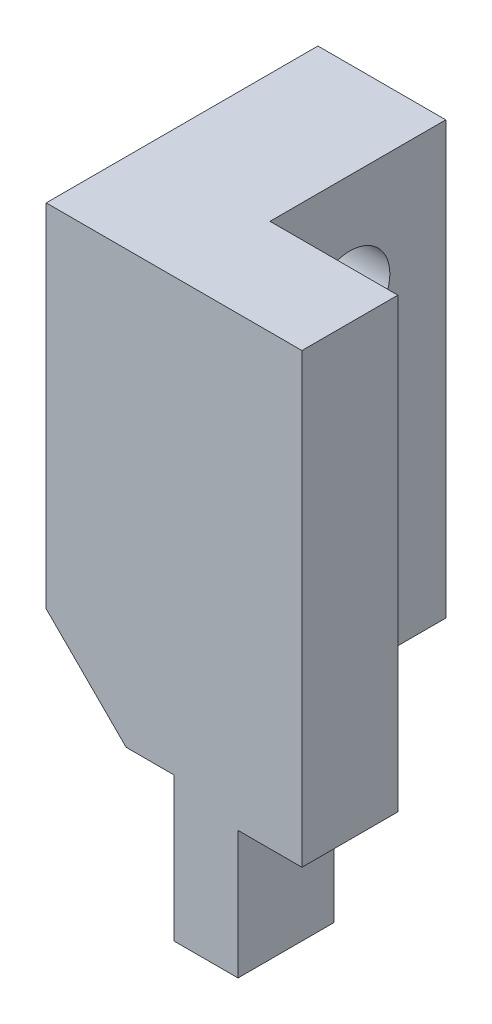
from build123d import *

# Parameters (mm, degrees)
SKETCH_1_W          = 8
SKETCH_1_H          = 18
EXTRUDE_1_DEPTH     = 8.5
SKETCH_2_W          = 2
SKETCH_2_H          = 4
CUT_EXTRUDE_1_DEPTH = 22.453437953
SKETCH_3_W          = 4
SKETCH_3_H          = 5.5
CUT_EXTRUDE_2_DEPTH = 22.453437953
SKETCH_4_W          = 5.5
SKETCH_4_H          = 4
CUT_EXTRUDE_3_DEPTH = 7
SKETCH_5_W          = 4
SKETCH_5_H          = 4.5
CUT_EXTRUDE_4_DEPTH = 22.453437953
CHAMFER_1_SIZE      = 2.5
HOLE_WIZARD_M3_1_D  = 2.5


with BuildPart() as part:
    # 草图1 → 凸台-拉伸1 (new body)
    with BuildSketch(Plane.XY):
        with Locations((4, 9)):
            Rectangle(SKETCH_1_W, SKETCH_1_H)
    extrude(amount=EXTRUDE_1_DEPTH)

    # 草图2 → 切除-拉伸1 (cut, through all)
    with BuildSketch(Plane.XY.offset(8.5)):
        with Locations((7, 2)):
            Rectangle(SKETCH_2_W, SKETCH_2_H)
    extrude(amount=-CUT_EXTRUDE_1_DEPTH, mode=Mode.SUBTRACT)

    # 草图3 → 切除-拉伸2 (cut, through all)
    with BuildSketch(Plane(origin=(0, 18, 0), x_dir=(1, 0, 0), z_dir=(0, 1, 0))):
        with Locations((6, -2.75)):
            Rectangle(SKETCH_3_W, SKETCH_3_H)
    extrude(amount=-CUT_EXTRUDE_2_DEPTH, mode=Mode.SUBTRACT)

    # 草图4 → 切除-拉伸3 (cut)
    with BuildSketch(Plane(origin=(4, 0, 0), x_dir=(0, 0, -1), z_dir=(1, 0, 0))):
        with Locations((-2.75, 2)):
            Rectangle(SKETCH_4_W, SKETCH_4_H)
    extrude(amount=-CUT_EXTRUDE_3_DEPTH, mode=Mode.SUBTRACT)

    # 草图5 → 切除-拉伸4 (cut, through all)
    with BuildSketch(Plane.XY.offset(8.5)):
        with Locations((2, 2.25)):
            Rectangle(SKETCH_5_W, SKETCH_5_H)
    extrude(amount=-CUT_EXTRUDE_4_DEPTH, mode=Mode.SUBTRACT)

    # 倒角1
    chamfer_1_edges = [part.edges().sort_by_distance(p)[0] for p in [
        (0, 4.5, 4.25),
    ]]
    chamfer(chamfer_1_edges, length=CHAMFER_1_SIZE)

    # M3 螺纹孔1 (through all)
    with Locations(Plane(origin=(4, 0, 0), x_dir=(0, 0, -1), z_dir=(1, 0, 0))):
        with Locations((-3, 14.7), (-3, 9)):
            Hole(HOLE_WIZARD_M3_1_D / 2)


solid = part.part
